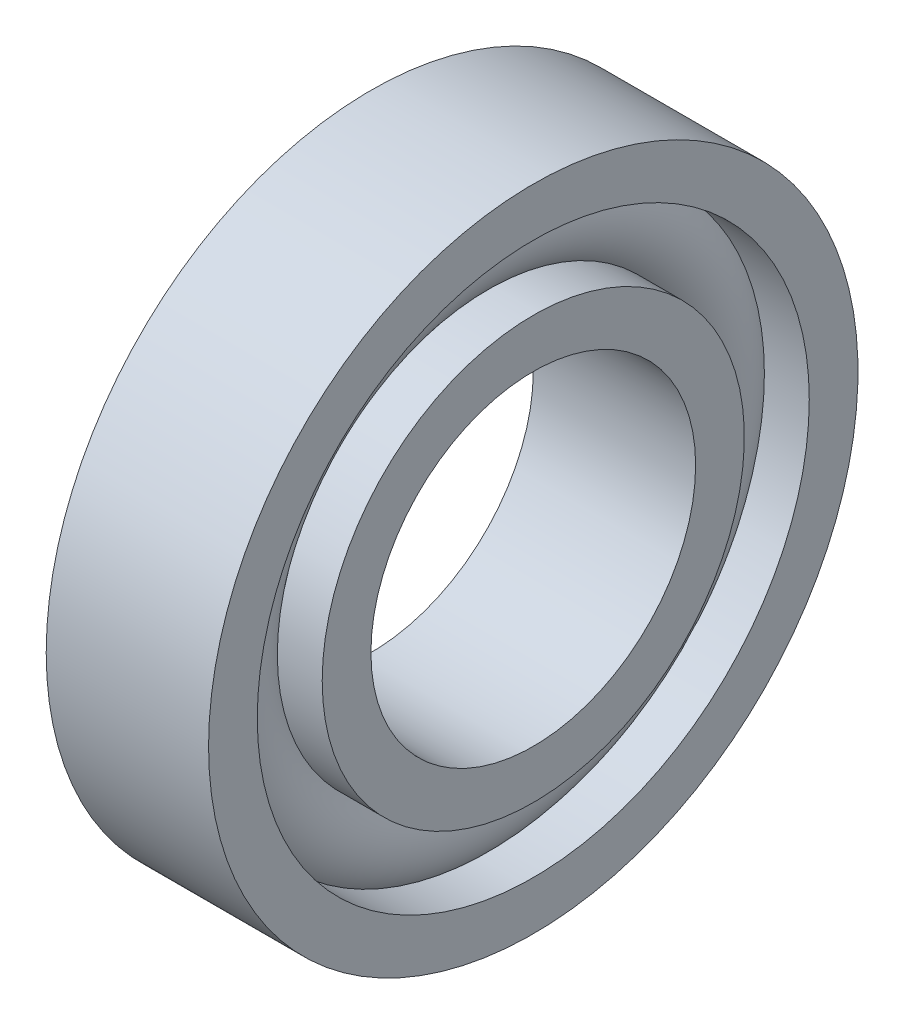
from build123d import *


with BuildPart() as part:
    # Esquisse1 → Révolution1 (revolve)
    with BuildSketch(Plane.XY, mode=Mode.PRIVATE) as r_volution1_sk:
        with BuildLine():
            Line((-2, 4), (2, 4))
            Line((2, 4), (2, 5.2))
            Line((2, 5.2), (0.894427191, 5.2))
            ThreePointArc((0.894427191, 5.2), (1.2, 6), (0.894427191, 6.8))
            Line((0.894427191, 6.8), (2, 6.8))
            Line((2, 6.8), (2, 8))
            Line((2, 8), (-2, 8))
            Line((-2, 8), (-2, 6.8))
            Line((-2, 6.8), (-0.894427191, 6.8))
            ThreePointArc((-0.894427191, 6.8), (-1.2, 6), (-0.894427191, 5.2))
            Line((-0.894427191, 5.2), (-2, 5.2))
            Line((-2, 5.2), (-2, 4))
        make_face()
    revolve(r_volution1_sk.sketch.rotate(Axis((-2, 0, 0), (1, 0, 0)), 90), axis=Axis((-2, 0, 0), (1, 0, 0)))


solid = part.part
